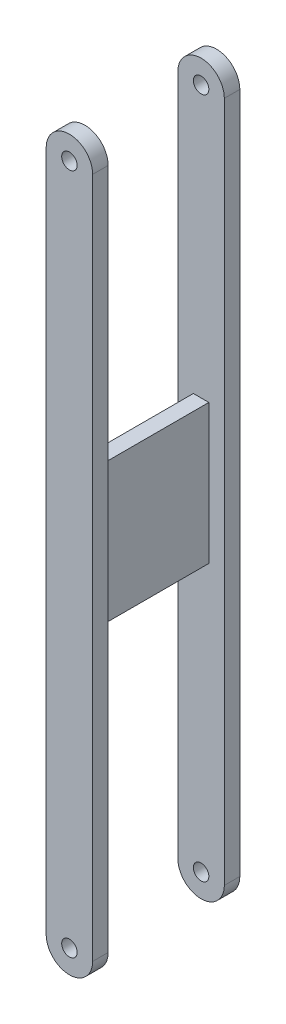
from build123d import *

# Parameters (mm, degrees)
ESQUISSE1_W             = 12
ESQUISSE1_H             = 188
BOSS_EXTRU_1_DEPTH      = 4
ESQUISSE2_R             = 2
BOSS_EXTRU_2_DEPTH      = 30
ESQUISSE3_W             = 12
ESQUISSE3_H             = 188
BOSS_EXTRU_3_DEPTH      = 4
ENL_V_MAT_EXTRU_1_DEPTH = 74
ENL_V_MAT_EXTRU_2_DEPTH = 74
ENL_V_START             = -74
ESQUISSE6_R             = 2
ENL_V_MAT_EXTRU_3_DEPTH = 74
ESQUISSE8_W             = 4
ESQUISSE8_H             = 36
BOSS_EXTRU_4_DEPTH      = 30
ESQUISSE7_R             = 2
ENL_V_MAT_EXTRU_6_DEPTH = 193.177001746


with BuildPart() as part:
    # Esquisse1 → Boss.-Extru.1 (new body)
    with BuildSketch(Plane.XY):
        with Locations((6, 94)):
            Rectangle(ESQUISSE1_W, ESQUISSE1_H)
    extrude(amount=BOSS_EXTRU_1_DEPTH)

    # Esquisse2 → Boss.-Extru.2 (add)
    with BuildSketch(Plane.XY.offset(4)):
        with Locations(Location((6, 182, 0), (0, 0, 180))):
            Circle(ESQUISSE2_R)
        with Locations(Location((6, 6, 0), (0, 0, 180))):
            Circle(ESQUISSE2_R)
    extrude(amount=BOSS_EXTRU_2_DEPTH)

    # Esquisse3 → Boss.-Extru.3 (add)
    with BuildSketch(Plane.XY.offset(34)):
        with Locations((6, 94)):
            Rectangle(ESQUISSE3_W, ESQUISSE3_H)
    extrude(amount=BOSS_EXTRU_3_DEPTH)

    # Esquisse4 → Enlèv. mat.-Extru.1 (cut)
    with BuildSketch(Plane.XY.offset(38)):
        with BuildLine():
            Line((0, 182), (0, 193.947131368))
            Line((0, 193.947131368), (12, 193.947131368))
            Line((12, 193.947131368), (12, 182))
            ThreePointArc((12, 182), (6, 188), (0, 182))
        make_face()
    extrude(amount=-ENL_V_MAT_EXTRU_1_DEPTH, mode=Mode.SUBTRACT)

    # Esquisse5 → Enlèv. mat.-Extru.2 (cut)
    with BuildSketch(Plane.XY.offset(38)):
        with BuildLine():
            Line((12, 6), (12, -5.88895182))
            Line((12, -5.88895182), (0, -5.88895182))
            Line((0, -5.88895182), (0, 6))
            ThreePointArc((0, 6), (6, 0), (12, 6))
        make_face()
    extrude(amount=-ENL_V_MAT_EXTRU_2_DEPTH, mode=Mode.SUBTRACT)

    # Esquisse6 → Enlèv. mat.-Extru.3 (cut)
    with BuildSketch(Plane.XY.offset(38).offset(ENL_V_START)):
        with Locations((6, 6)):
            Circle(ESQUISSE6_R)
    extrude(amount=ENL_V_MAT_EXTRU_3_DEPTH, mode=Mode.SUBTRACT)

    # Esquisse8 → Boss.-Extru.4 (add)
    with BuildSketch(Plane.XY.offset(4)):
        with Locations((6, 94)):
            Rectangle(ESQUISSE8_W, ESQUISSE8_H)
    extrude(amount=BOSS_EXTRU_4_DEPTH)

    # Esquisse7 → Enlèv. mat.-Extru.6 (cut, through all)
    with BuildSketch(Plane.XY.offset(38)):
        with Locations((6, 182)):
            Circle(ESQUISSE7_R)
    extrude(amount=-ENL_V_MAT_EXTRU_6_DEPTH, mode=Mode.SUBTRACT)


solid = part.part
